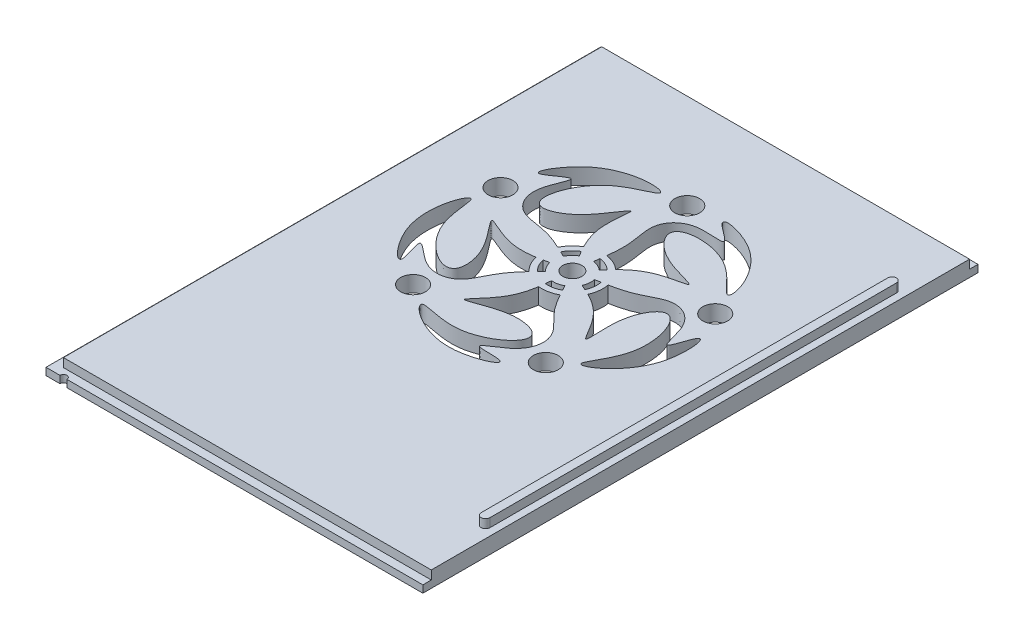
from build123d import *

# Parameters (mm, degrees)
SKETCH1_W           = 64.9
SKETCH1_H           = 95.6
BOSS_EXTRUDE1_DEPTH = 1.25
BOSS_EXTRUDE2_DEPTH = 3
SKETCH3_R           = 1.645121697
SKETCH3_R_2         = 2.139292183
CUT_EXTRUDE1_DEPTH  = 116.587066751
SKETCH4_R           = 0.6
CUT_EXTRUDE2_DEPTH  = 116.587066889
BOSS_EXTRUDE3_START = 1.5
SKETCH5_W           = 63.35
SKETCH5_H           = 92.7
SKETCH5_R           = 2.139292183
SKETCH5_R_2         = 1.645121697
BOSS_EXTRUDE3_DEPTH = 1.5


with BuildPart() as part:
    # Sketch1 → Boss-Extrude1 (new body)
    with BuildSketch(Plane(origin=(0, 0, 0), x_dir=(1, 0, 0), z_dir=(0, 1, 0))):
        with Locations((-32.45, 47.8)):
            Rectangle(SKETCH1_W, SKETCH1_H)
    extrude(amount=BOSS_EXTRUDE1_DEPTH)

    # Sketch2 → Boss-Extrude2 (add)
    with BuildSketch(Plane(origin=(0, 1.25, 0), x_dir=(1, 0, 0), z_dir=(0, 1, 0))):
        with BuildLine():
            Line((-2.75, 12.8), (-2.75, 82.8))
            ThreePointArc((-2.75, 82.8), (-2, 83.55), (-1.25, 82.8))
            Line((-1.25, 82.8), (-1.25, 12.8))
            ThreePointArc((-1.25, 12.8), (-2, 12.05), (-2.75, 12.8))
        make_face()
    extrude(amount=BOSS_EXTRUDE2_DEPTH)

    # Sketch3 → Cut-Extrude1 (cut, through all)
    with BuildSketch(Plane(origin=(0, 1.25, 0), x_dir=(1, 0, 0), z_dir=(0, 1, 0))):
        with Locations(Location((-32.45, 58.197283823, 0), (0, 0, 270))):
            Circle(SKETCH3_R)
        with Locations(Location((-32.278200751, 77.808401471, 0), (0, 0, 270))):
            Circle(SKETCH3_R_2)
        with Locations(Location((-51.048192343, 64.42084325, 0), (0, 0, 270))):
            Circle(SKETCH3_R_2)
        with Locations(Location((-44.116114247, 42.432537432, 0), (0, 0, 270))):
            Circle(SKETCH3_R_2)
        with Locations(Location((-21.061862778, 42.230575302, 0), (0, 0, 270))):
            Circle(SKETCH3_R_2)
        with Locations(Location((-13.745629882, 64.094061659, 0), (0, 0, 270))):
            Circle(SKETCH3_R_2)
        with BuildLine():
            Line((-36.290487748, 60.017027837), (-35.40243664, 59.596241262))
            ThreePointArc((-35.40243664, 59.596241262), (-34.85404757, 60.409639877), (-34.088913337, 61.023575935))
            Line((-34.088913337, 61.023575935), (-34.581875247, 61.873684556))
            ThreePointArc((-34.581875247, 61.873684556), (-35.577151016, 61.07508523), (-36.290487748, 60.017027837))
        make_face()
        with BuildLine():
            Line((-32.031865763, 61.437519584), (-31.906096908, 62.41213659))
            ThreePointArc((-31.906096908, 62.41213659), (-30.679391178, 62.060670785), (-29.612320807, 61.360887973))
            Line((-29.612320807, 61.360887973), (-30.268488543, 60.629355325))
            ThreePointArc((-30.268488543, 60.629355325), (-31.08881603, 61.167324602), (-32.031865763, 61.437519584))
        make_face()
        with BuildLine():
            Line((-29.462838436, 56.874094563), (-28.564342563, 56.476097982))
            ThreePointArc((-28.564342563, 56.476097982), (-28.228552438, 57.707186992), (-28.273361512, 58.982462377))
            Line((-28.273361512, 58.982462377), (-29.23914208, 58.800902448))
            ThreePointArc((-29.23914208, 58.800902448), (-29.204694384, 57.820514013), (-29.462838436, 56.874094563))
        make_face()
        with BuildLine():
            Line((-35.644415604, 57.511956908), (-36.605250555, 57.305820282))
            ThreePointArc((-36.605250555, 57.305820282), (-36.153294589, 56.112476013), (-35.367455384, 55.107094751))
            Line((-35.367455384, 55.107094751), (-34.692840685, 55.821651341))
            ThreePointArc((-34.692840685, 55.821651341), (-35.296967196, 56.594554334), (-35.644415604, 57.511956908))
        make_face()
        with BuildLine():
            Line((-30.88371491, 55.330104888), (-30.412598547, 54.46769809))
            ThreePointArc((-30.412598547, 54.46769809), (-31.611610747, 54.031000362), (-32.886210828, 53.969928322))
            Line((-32.886210828, 53.969928322), (-32.78534408, 54.947436384))
            ThreePointArc((-32.78534408, 54.947436384), (-31.805474796, 54.994386495), (-30.88371491, 55.330104888))
        make_face()
        with BuildLine():
            ThreePointArc((-35.099187188, 62.7657846), (-36.335972418, 61.773400498), (-37.222404461, 60.458599318))
            add(Edge.make_bspline(
                [(-37.222404461, 60.458599318), (-38.122816525, 60.882285671), (-41.539834918, 62.313246525), (-45.90982231, 61.884670669), (-48.691343355, 66.987377496), (-44.648764538, 73.806147464), (-52.268702858, 67.222223022), (-45.819876724, 78.934156003), (-32.133516717, 77.90012819), (-44.348378451, 74.80393458), (-47.638100657, 63.360197176), (-39.501174756, 66.505086005), (-35.179205216, 75.330719358), (-37.154989409, 67.654888249), (-35.639363009, 63.829491785), (-35.099187188, 62.7657846)],
                knots=[0.085804232, 0.085804232, 0.085804232, 0.085804232, 0.112267785, 0.182407095, 0.240428272, 0.290228951, 0.334834621, 0.410844098, 0.525210243, 0.604529247, 0.709593493, 0.765862393, 0.843892563, 0.912603651, 0.943372553, 0.943372553, 0.943372553, 0.943372553], degree=3))
        make_face()
        with BuildLine():
            ThreePointArc((-37.613546296, 57.089501463), (-37.051920583, 55.606585259), (-36.075392919, 54.35724238))
            add(Edge.make_bspline(
                [(-36.075392919, 54.35724238), (-36.756585217, 53.631825902), (-39.173426613, 50.824239516), (-40.116227123, 46.535697307), (-45.828726974, 45.467136719), (-51.064537031, 51.418973446), (-47.157543224, 42.137436911), (-56.303456535, 51.889821356), (-51.090719812, 64.586791059), (-51.920664563, 52.012990767), (-42.053603603, 45.347969689), (-42.530122231, 54.058470184), (-49.588236305, 60.89617817), (-42.898638004, 56.64513348), (-38.792115454, 56.904467327), (-37.613546296, 57.089501463)],
                knots=[0.091656195, 0.091656195, 0.091656195, 0.091656195, 0.118119748, 0.188259058, 0.246280235, 0.296080914, 0.340686584, 0.416696061, 0.531062206, 0.61038121, 0.715445456, 0.771714356, 0.849744525, 0.918455614, 0.949224515, 0.949224515, 0.949224515, 0.949224515], degree=3))
        make_face()
        with BuildLine():
            ThreePointArc((-32.992059925, 52.944135896), (-31.408170713, 53.020027422), (-29.918211222, 53.562692397))
            add(Edge.make_bspline(
                [(-29.918211222, 53.562692397), (-29.438799264, 52.69067392), (-27.515471292, 49.524528628), (-23.728166578, 47.302640284), (-24.47716465, 41.53952653), (-31.75565203, 38.399193988), (-21.721058746, 39.246813375), (-33.822370163, 33.562185457), (-44.287081702, 42.443372099), (-32.585154032, 37.768529761), (-23.197252787, 45.093057604), (-31.628683386, 47.331554138), (-40.312807369, 42.731856732), (-34.20262391, 47.780397714), (-33.18028, 51.766071339), (-32.992059925, 52.944135896)],
                knots=[0.085804214, 0.085804214, 0.085804214, 0.085804214, 0.112267764, 0.182407074, 0.24042825, 0.290228929, 0.334834599, 0.410844077, 0.525210222, 0.604529225, 0.709593471, 0.765862371, 0.843892541, 0.91260363, 0.943372531, 0.943372531, 0.943372531, 0.943372531], degree=3))
        make_face()
        with BuildLine():
            ThreePointArc((-27.621465162, 56.058442216), (-27.204193608, 57.588262143), (-27.259875865, 59.172990525))
            add(Edge.make_bspline(
                [(-27.259875865, 59.172990525), (-26.282390568, 59.359469863), (-22.676866428, 60.210270763), (-19.39338352, 63.125610331), (-14.143789763, 60.632370744), (-13.40633233, 52.739701769), (-11.111606414, 62.545095896), (-9.444714872, 49.279418183), (-21.124999008, 42.071323686), (-13.062865222, 51.755912521), (-17.12788413, 62.947740753), (-21.862276187, 55.620707212), (-20.171245889, 45.940229842), (-23.084543159, 53.311444597), (-26.55922239, 55.515392319), (-27.621465162, 56.058442216)],
                knots=[0.085804241, 0.085804241, 0.085804241, 0.085804241, 0.112267791, 0.182407101, 0.240428277, 0.290228956, 0.334834626, 0.410844104, 0.525210249, 0.604529252, 0.709593498, 0.765862398, 0.843892568, 0.912603657, 0.943372558, 0.943372558, 0.943372558, 0.943372558], degree=3))
        make_face()
        with BuildLine():
            ThreePointArc((-28.923741429, 62.12855494), (-30.249742638, 62.998144126), (-31.774115656, 63.434895154))
            add(Edge.make_bspline(
                [(-31.774115656, 63.434895154), (-31.649408478, 64.4221642), (-31.344399984, 68.114133365), (-33.102400659, 72.137800652), (-29.108975219, 76.360007599), (-21.37471408, 74.622402452), (-29.991088753, 79.834849909), (-16.859581707, 77.320838117), (-13.613682762, 63.984804081), (-20.332937731, 74.645051486), (-32.233158825, 74.237453887), (-26.727743434, 67.470601588), (-16.998505251, 66.087434951), (-24.909205442, 65.594555226), (-28.079019218, 62.970996203), (-28.923741429, 62.12855494)],
                knots=[0.085804241, 0.085804241, 0.085804241, 0.085804241, 0.112267791, 0.182407101, 0.240428277, 0.290228956, 0.334834626, 0.410844104, 0.525210249, 0.604529252, 0.709593498, 0.765862398, 0.843892568, 0.912603657, 0.943372558, 0.943372558, 0.943372558, 0.943372558], degree=3))
        make_face()
    extrude(amount=-CUT_EXTRUDE1_DEPTH, mode=Mode.SUBTRACT)

    # Sketch4 → Cut-Extrude2 (cut, through all)
    with BuildSketch(Plane(origin=(0, 1.25, 0), x_dir=(1, 0, 0), z_dir=(0, 1, 0))):
        with Locations((-61.9, 95.6)):
            Circle(SKETCH4_R)
        with Locations((-61.9, 0)):
            Circle(SKETCH4_R)
    extrude(amount=-CUT_EXTRUDE2_DEPTH, mode=Mode.SUBTRACT)

    # Sketch5 → Boss-Extrude3 (add)
    with BuildSketch(Plane(origin=(0, 1.25, 0), x_dir=(1, 0, 0), z_dir=(0, 1, 0)).offset(BOSS_EXTRUDE3_START)):
        with Locations((-31.675, 47.8)):
            Rectangle(SKETCH5_W, SKETCH5_H)
        with Locations(Location((-21.061862778, 42.230575302, 0), (0, 0, 270))):
            Circle(SKETCH5_R, mode=Mode.SUBTRACT)
        with Locations(Location((-13.745629882, 64.094061659, 0), (0, 0, 270))):
            Circle(SKETCH5_R, mode=Mode.SUBTRACT)
        with Locations(Location((-51.048192343, 64.42084325, 0), (0, 0, 270))):
            Circle(SKETCH5_R, mode=Mode.SUBTRACT)
        with Locations(Location((-32.278200751, 77.808401471, 0), (0, 0, 270))):
            Circle(SKETCH5_R, mode=Mode.SUBTRACT)
        with Locations(Location((-32.45, 58.197283823, 0), (0, 0, 270))):
            Circle(SKETCH5_R_2, mode=Mode.SUBTRACT)
        with Locations(Location((-44.116114247, 42.432537432, 0), (0, 0, 270))):
            Circle(SKETCH5_R, mode=Mode.SUBTRACT)
        with BuildLine():
            Line((-31.906096908, 62.41213659), (-32.031865763, 61.437519584))
            ThreePointArc((-32.031865763, 61.437519584), (-31.08881603, 61.167324602), (-30.268488543, 60.629355325))
            Line((-30.268488543, 60.629355325), (-29.612320807, 61.360887973))
            ThreePointArc((-29.612320807, 61.360887973), (-30.679391178, 62.060670785), (-31.906096908, 62.41213659))
        make_face(mode=Mode.SUBTRACT)
        with BuildLine():
            Line((-29.462838436, 56.874094563), (-28.564342563, 56.476097982))
            ThreePointArc((-28.564342563, 56.476097982), (-28.228552438, 57.707186992), (-28.273361512, 58.982462377))
            Line((-28.273361512, 58.982462377), (-29.23914208, 58.800902448))
            ThreePointArc((-29.23914208, 58.800902448), (-29.204694384, 57.820514013), (-29.462838436, 56.874094563))
        make_face(mode=Mode.SUBTRACT)
        with BuildLine():
            Line((-32.78534408, 54.947436384), (-32.886210828, 53.969928322))
            ThreePointArc((-32.886210828, 53.969928322), (-31.611610747, 54.031000362), (-30.412598547, 54.46769809))
            Line((-30.412598547, 54.46769809), (-30.88371491, 55.330104888))
            ThreePointArc((-30.88371491, 55.330104888), (-31.805474796, 54.994386495), (-32.78534408, 54.947436384))
        make_face(mode=Mode.SUBTRACT)
        with BuildLine():
            Line((-34.088913337, 61.023575935), (-34.581875247, 61.873684556))
            ThreePointArc((-34.581875247, 61.873684556), (-35.577151016, 61.07508523), (-36.290487748, 60.017027837))
            Line((-36.290487748, 60.017027837), (-35.40243664, 59.596241262))
            ThreePointArc((-35.40243664, 59.596241262), (-34.85404757, 60.409639877), (-34.088913337, 61.023575935))
        make_face(mode=Mode.SUBTRACT)
        with BuildLine():
            Line((-35.644415604, 57.511956908), (-36.605250555, 57.305820282))
            ThreePointArc((-36.605250555, 57.305820282), (-36.153294589, 56.112476013), (-35.367455384, 55.107094751))
            Line((-35.367455384, 55.107094751), (-34.692840685, 55.821651341))
            ThreePointArc((-34.692840685, 55.821651341), (-35.296967196, 56.594554334), (-35.644415604, 57.511956908))
        make_face(mode=Mode.SUBTRACT)
        with BuildLine():
            ThreePointArc((-27.621465162, 56.058442216), (-27.204193608, 57.588262143), (-27.259875865, 59.172990525))
            add(Edge.make_bspline(
                [(-27.621465162, 56.058442216), (-26.55922239, 55.515392319), (-23.084543159, 53.311444597), (-20.171245889, 45.940229842), (-21.862276187, 55.620707212), (-17.12788413, 62.947740753), (-13.062865222, 51.755912521), (-21.124999008, 42.071323686), (-9.444714872, 49.279418183), (-11.111606414, 62.545095896), (-13.40633233, 52.739701769), (-14.143789763, 60.632370744), (-19.39338352, 63.125610331), (-22.676866428, 60.210270763), (-26.282390568, 59.359469863), (-27.259875865, 59.172990525)],
                knots=[0.085804241, 0.085804241, 0.085804241, 0.085804241, 0.116573143, 0.185284231, 0.263314401, 0.319583301, 0.424647547, 0.503966551, 0.618332696, 0.694342173, 0.738947843, 0.788748522, 0.846769698, 0.916909009, 0.943372558, 0.943372558, 0.943372558, 0.943372558], degree=3))
        make_face(mode=Mode.SUBTRACT)
        with BuildLine():
            ThreePointArc((-35.099187188, 62.7657846), (-36.335972418, 61.773400498), (-37.222404461, 60.458599318))
            add(Edge.make_bspline(
                [(-35.099187188, 62.7657846), (-35.639363009, 63.829491785), (-37.154989409, 67.654888249), (-35.179205216, 75.330719358), (-39.501174756, 66.505086005), (-47.638100657, 63.360197176), (-44.348378451, 74.80393458), (-32.133516717, 77.90012819), (-45.819876724, 78.934156003), (-52.268702858, 67.222223022), (-44.648764538, 73.806147464), (-48.691343355, 66.987377496), (-45.90982231, 61.884670669), (-41.539834918, 62.313246525), (-38.122816525, 60.882285671), (-37.222404461, 60.458599318)],
                knots=[0.085804232, 0.085804232, 0.085804232, 0.085804232, 0.116573133, 0.185284222, 0.263314392, 0.319583292, 0.424647538, 0.503966542, 0.618332686, 0.694342164, 0.738947834, 0.788748513, 0.846769689, 0.916908999, 0.943372553, 0.943372553, 0.943372553, 0.943372553], degree=3))
        make_face(mode=Mode.SUBTRACT)
        with BuildLine():
            ThreePointArc((-28.923741429, 62.12855494), (-30.249742638, 62.998144126), (-31.774115656, 63.434895154))
            add(Edge.make_bspline(
                [(-28.923741429, 62.12855494), (-28.079019218, 62.970996203), (-24.909205442, 65.594555226), (-16.998505251, 66.087434951), (-26.727743434, 67.470601588), (-32.233158825, 74.237453887), (-20.332937731, 74.645051486), (-13.613682762, 63.984804081), (-16.859581707, 77.320838117), (-29.991088753, 79.834849909), (-21.37471408, 74.622402452), (-29.108975219, 76.360007599), (-33.102400659, 72.137800652), (-31.344399984, 68.114133365), (-31.649408478, 64.4221642), (-31.774115656, 63.434895154)],
                knots=[0.085804241, 0.085804241, 0.085804241, 0.085804241, 0.116573143, 0.185284231, 0.263314401, 0.319583301, 0.424647547, 0.503966551, 0.618332696, 0.694342173, 0.738947843, 0.788748522, 0.846769698, 0.916909009, 0.943372558, 0.943372558, 0.943372558, 0.943372558], degree=3))
        make_face(mode=Mode.SUBTRACT)
        with BuildLine():
            ThreePointArc((-32.992059925, 52.944135896), (-31.408170713, 53.020027422), (-29.918211222, 53.562692397))
            add(Edge.make_bspline(
                [(-32.992059925, 52.944135896), (-33.18028, 51.766071339), (-34.20262391, 47.780397714), (-40.312807369, 42.731856732), (-31.628683386, 47.331554138), (-23.197252787, 45.093057604), (-32.585154032, 37.768529761), (-44.287081702, 42.443372099), (-33.822370163, 33.562185457), (-21.721058746, 39.246813375), (-31.75565203, 38.399193988), (-24.47716465, 41.53952653), (-23.728166578, 47.302640284), (-27.515471292, 49.524528628), (-29.438799264, 52.69067392), (-29.918211222, 53.562692397)],
                knots=[0.085804214, 0.085804214, 0.085804214, 0.085804214, 0.116573116, 0.185284204, 0.263314374, 0.319583274, 0.42464752, 0.503966524, 0.618332669, 0.694342146, 0.738947816, 0.788748495, 0.846769671, 0.916908981, 0.943372531, 0.943372531, 0.943372531, 0.943372531], degree=3))
        make_face(mode=Mode.SUBTRACT)
        with BuildLine():
            ThreePointArc((-37.613546296, 57.089501463), (-37.051920583, 55.606585259), (-36.075392919, 54.35724238))
            add(Edge.make_bspline(
                [(-37.613546296, 57.089501463), (-38.792115454, 56.904467327), (-42.898638004, 56.64513348), (-49.588236305, 60.89617817), (-42.530122231, 54.058470184), (-42.053603603, 45.347969689), (-51.920664563, 52.012990767), (-51.090719812, 64.586791059), (-56.303456535, 51.889821356), (-47.157543224, 42.137436911), (-51.064537031, 51.418973446), (-45.828726974, 45.467136719), (-40.116227123, 46.535697307), (-39.173426613, 50.824239516), (-36.756585217, 53.631825902), (-36.075392919, 54.35724238)],
                knots=[0.091656195, 0.091656195, 0.091656195, 0.091656195, 0.122425096, 0.191136185, 0.269166355, 0.325435255, 0.430499501, 0.509818504, 0.624184649, 0.700194127, 0.744799797, 0.794600476, 0.852621652, 0.922760962, 0.949224515, 0.949224515, 0.949224515, 0.949224515], degree=3))
        make_face(mode=Mode.SUBTRACT)
    extrude(amount=-BOSS_EXTRUDE3_DEPTH)


solid = part.part
